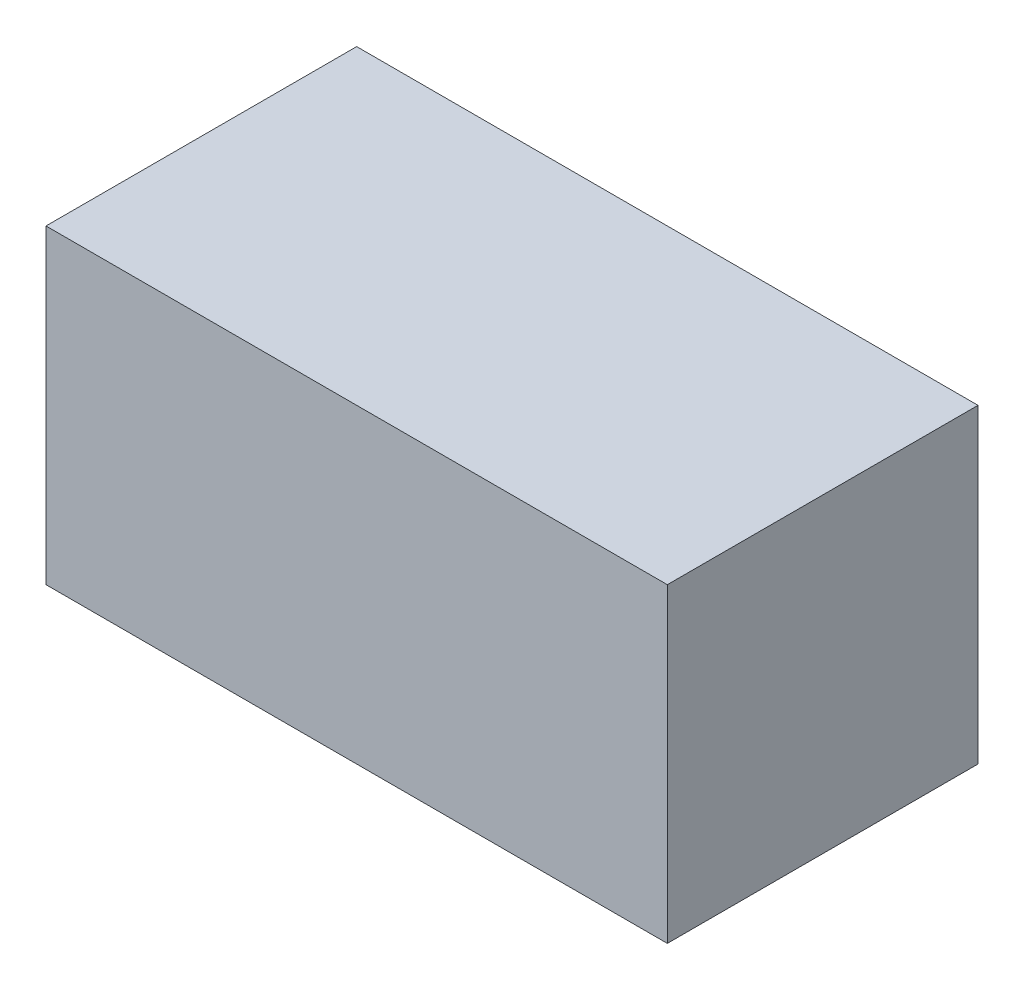
from build123d import *

# Parameters (mm, degrees)
SKETCH1_W           = 70
SKETCH1_H           = 35
BOSS_EXTRUDE1_DEPTH = 35


with BuildPart() as part:
    # Sketch1 → Boss-Extrude1 (new body)
    with BuildSketch(Plane.XY):
        with Locations((35, 17.5)):
            Rectangle(SKETCH1_W, SKETCH1_H)
    extrude(amount=BOSS_EXTRUDE1_DEPTH)


solid = part.part
